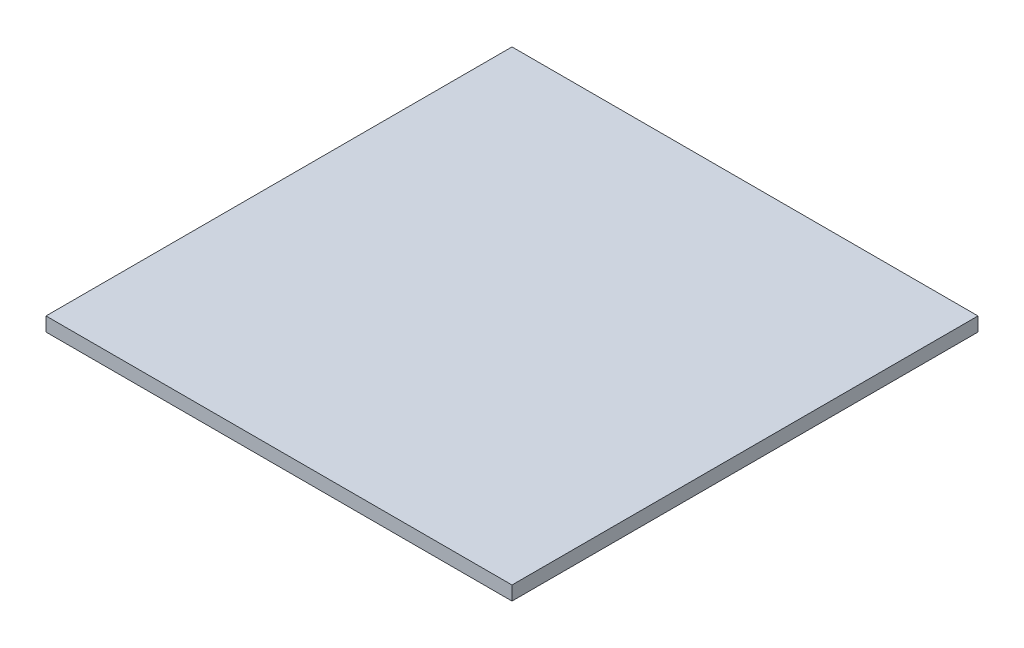
from build123d import *

# Parameters (mm, degrees)
SKETCH1_W           = 10
SKETCH1_H           = 10
BOSS_EXTRUDE1_DEPTH = 0.3


with BuildPart() as part:
    # Sketch1 → Boss-Extrude1 (new body)
    with BuildSketch(Plane(origin=(0, 0, 0), x_dir=(1, 0, 0), z_dir=(0, 1, 0))):
        with Locations((5, -5)):
            Rectangle(SKETCH1_W, SKETCH1_H)
    extrude(amount=BOSS_EXTRUDE1_DEPTH)


solid = part.part
